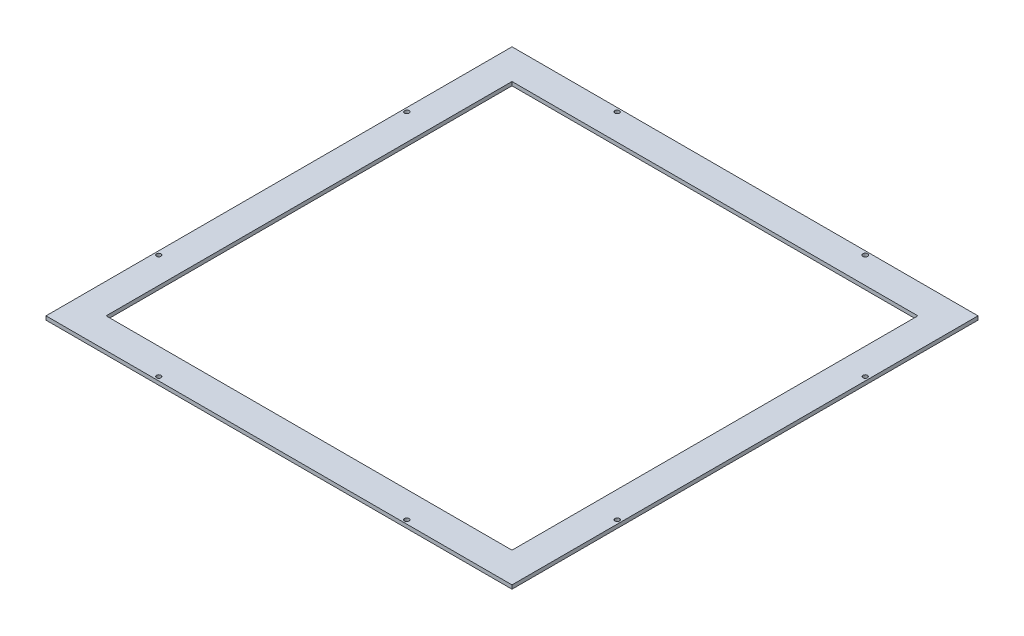
from build123d import *

# Parameters (mm, degrees)
SKETCH1_W           = 393.7
SKETCH1_H           = 393.7
BOSS_EXTRUDE1_DEPTH = 3.175
SKETCH2_W           = 342.9
SKETCH2_H           = 342.9
CUT_EXTRUDE1_DEPTH  = 279.40604452
SKETCH3_R           = 1.905
SKETCH3_R_2         = 2.01965575
CUT_EXTRUDE2_DEPTH  = 279.40604452


with BuildPart() as part:
    # Sketch1 → Boss-Extrude1 (new body)
    with BuildSketch(Plane(origin=(0, 0, 0), x_dir=(1, 0, 0), z_dir=(0, 1, 0))):
        Rectangle(SKETCH1_W, SKETCH1_H)
    extrude(amount=BOSS_EXTRUDE1_DEPTH)

    # Sketch2 → Cut-Extrude1 (cut, through all)
    with BuildSketch(Plane(origin=(0, 3.175, 0), x_dir=(1, 0, 0), z_dir=(0, 1, 0))):
        Rectangle(SKETCH2_W, SKETCH2_H)
    extrude(amount=-CUT_EXTRUDE1_DEPTH, mode=Mode.SUBTRACT)

    # Sketch3 → Cut-Extrude2 (cut, through all)
    with BuildSketch(Plane(origin=(0, 3.175, 0), x_dir=(1, 0, 0), z_dir=(0, 1, 0))):
        with Locations(Location((-104.775, -193.675, 0), (0, 0, 270))):
            Circle(SKETCH3_R)
        with Locations(Location((104.775, -193.675, 0), (0, 0, 270))):
            Circle(SKETCH3_R)
        with Locations(Location((-193.675, -104.775, 0), (0, 0, 270))):
            Circle(SKETCH3_R)
        with Locations(Location((-193.675, 104.775, 0), (0, 0, 270))):
            Circle(SKETCH3_R)
        with Locations(Location((-104.775, 193.675, 0), (0, 0, 270))):
            Circle(SKETCH3_R)
        with Locations(Location((104.775, 193.675, 0), (0, 0, 270))):
            Circle(SKETCH3_R_2)
        with Locations(Location((193.675, 104.775, 0), (0, 0, 270))):
            Circle(SKETCH3_R)
        with Locations(Location((193.675, -104.775, 0), (0, 0, 270))):
            Circle(SKETCH3_R)
    extrude(amount=-CUT_EXTRUDE2_DEPTH, mode=Mode.SUBTRACT)


solid = part.part
